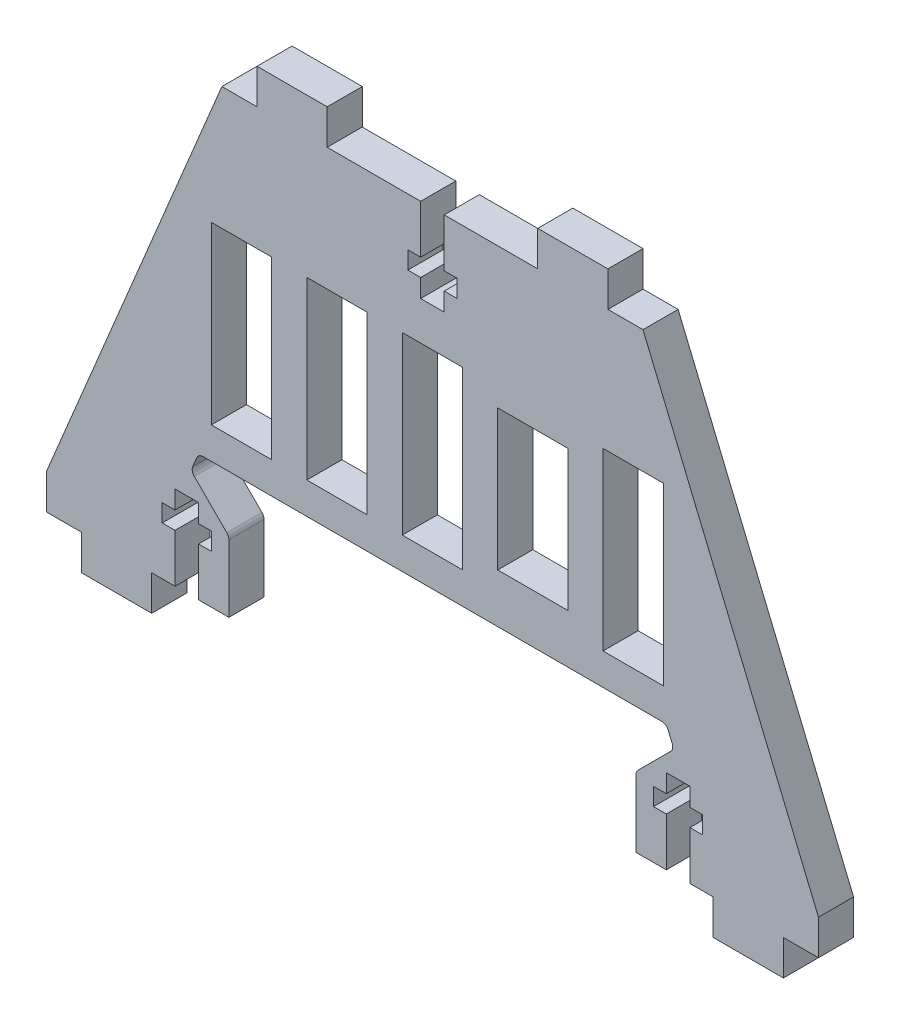
from build123d import *

# Parameters (mm, degrees)
SKETCH1_W               = 139.7
SKETCH1_H               = 82.55
BOSS_EXTRUDE1_DEPTH     = 6.35
SKETCH2_W               = 12.7
SKETCH2_H               = 6.35
BOSS_EXTRUDE2_DEPTH     = 6.35
CUT_EXTRUDE1_DEPTH      = 6.35
CUT_EXTRUDE8_DEPTH      = 6.35
CUT_EXTRUDE2_DEPTH      = 6.35
CUT_EXTRUDE9_DEPTH      = 85.77904001
CUT_EXTRUDE9_DEPTH_BACK = 85.77904001
FILLET1_R               = 1.27
SKETCH9_W               = 10.922
SKETCH9_H               = 31.75
SKETCH9_W_2             = 12.7
SKETCH9_H_2             = 25.4
CUT_EXTRUDE10_DEPTH     = 6.35


with BuildPart() as part:
    # Sketch1 → Boss-Extrude1 (new body)
    with BuildSketch(Plane.XY):
        Rectangle(SKETCH1_W, SKETCH1_H)
    extrude(amount=BOSS_EXTRUDE1_DEPTH)

    # Sketch2 → Boss-Extrude2 (add)
    with BuildSketch(Plane(origin=(0, 0, 0), x_dir=(-1, 0, 0), z_dir=(0, 0, -1))):
        with Locations((-57.15, -44.45)):
            Rectangle(SKETCH2_W, SKETCH2_H)
        with Locations((-25.4, 44.45)):
            Rectangle(SKETCH2_W, SKETCH2_H)
    boss_extrude2 = extrude(amount=-BOSS_EXTRUDE2_DEPTH)

    # Sketch3 → Cut-Extrude1 (cut)
    with BuildSketch(Plane(origin=(0, 0, 0), x_dir=(-1, 0, 0), z_dir=(0, 0, -1))):
        Polygon((-46.5836, -41.275), (-46.5836, -32.512), (-48.895, -32.512), (-48.895, -29.337), (-46.5836, -29.337), (-46.5836, -26.035), (-42.3164, -26.035), (-42.3164, -29.337), (-40.005, -29.337), (-40.005, -32.512), (-42.3164, -32.512), (-42.3164, -41.275), align=None)
    cut_extrude1 = extrude(amount=-CUT_EXTRUDE1_DEPTH, mode=Mode.SUBTRACT)

    # Sketch7 → Cut-Extrude8 (cut)
    with BuildSketch(Plane(origin=(0, 0, 0), x_dir=(-1, 0, 0), z_dir=(0, 0, -1))):
        Polygon((-38.1, 41.275), (-69.85, -34.925), (-69.85, 41.275), align=None)
    cut_extrude8 = extrude(amount=-CUT_EXTRUDE8_DEPTH, mode=Mode.SUBTRACT)

    # Mirror2: Boss-Extrude2, Cut-Extrude8 across plane
    add(boss_extrude2.mirror(Plane(origin=(0, 0, 0), x_dir=(0, 0, 1), z_dir=(1, 0, 0))))
    add(cut_extrude8.mirror(Plane(origin=(0, 0, 0), x_dir=(0, 0, 1), z_dir=(1, 0, 0))), mode=Mode.SUBTRACT)

    # Mirror4: Cut-Extrude1 across plane
    add(cut_extrude1.mirror(Plane(origin=(0, 0, 0), x_dir=(0, 0, 1), z_dir=(1, 0, 0))), mode=Mode.SUBTRACT)

    # Sketch4 → Cut-Extrude2 (cut)
    with BuildSketch(Plane(origin=(0, 0, 0), x_dir=(-1, 0, 0), z_dir=(0, 0, -1))):
        Polygon((2.1336, 41.275), (-2.1336, 41.275), (-2.1336, 32.512), (-4.445, 32.512), (-4.445, 29.337), (-2.1336, 29.337), (-2.1336, 26.035), (2.1336, 26.035), (2.1336, 29.337), (4.445, 29.337), (4.445, 32.512), (2.1336, 32.512), align=None)
    extrude(amount=-CUT_EXTRUDE2_DEPTH, mode=Mode.SUBTRACT)

    # Sketch8 → Cut-Extrude9 (cut, two sides: drawn at the far end of the back side and taken through both)
    with BuildSketch(Plane.XY.offset(6.35).offset(-CUT_EXTRUDE9_DEPTH_BACK)):
        Polygon((-36.83, -28.575), (-43.702941176, -21.702058824), (-42.333333333, -18.415), (42.333333333, -18.415), (43.702941176, -21.702058824), (36.83, -28.575), (36.83, -41.275), (-36.83, -41.275), align=None)
    extrude(amount=CUT_EXTRUDE9_DEPTH + CUT_EXTRUDE9_DEPTH_BACK, mode=Mode.SUBTRACT)

    # Fillet1
    fillet1_edges = [part.edges().sort_by_distance(p)[0] for p in [
        (-36.83, -28.575, 3.175),
        (-43.702941176, -21.702058824, 3.175),
        (-42.333333333, -18.415, 3.175),
        (42.333333333, -18.415, 3.175),
        (43.702941176, -21.702058824, 3.175),
        (36.83, -28.575, 3.175),
    ]]
    fillet(fillet1_edges, radius=FILLET1_R)

    # Sketch9 → Cut-Extrude10 (cut)
    with BuildSketch(Plane.XY.offset(6.35)):
        with Locations((0, 3.175)):
            Rectangle(SKETCH9_W, SKETCH9_H)
        with Locations((-34.544, 3.175)):
            Rectangle(SKETCH9_W, SKETCH9_H)
        with Locations((-17.272, 3.175)):
            Rectangle(SKETCH9_W, SKETCH9_H)
        with Locations((36.322, 3.175)):
            Rectangle(SKETCH9_W, SKETCH9_H)
        with Locations((18.161, 3.175)):
            Rectangle(SKETCH9_W_2, SKETCH9_H_2)
    extrude(amount=-CUT_EXTRUDE10_DEPTH, mode=Mode.SUBTRACT)


solid = part.part
